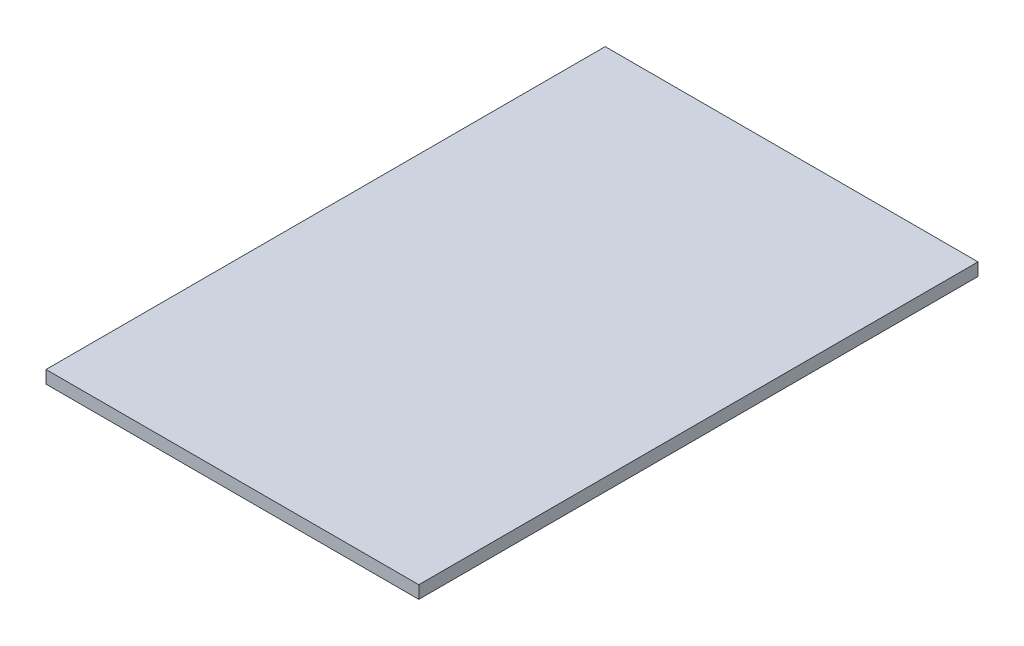
from build123d import *

# Parameters (mm, degrees)
SKETCH1_W           = 558.8
SKETCH1_H           = 838.2
BOSS_EXTRUDE1_DEPTH = 19.05


with BuildPart() as part:
    # Sketch1 → Boss-Extrude1 (new body)
    with BuildSketch(Plane(origin=(0, 0, 0), x_dir=(1, 0, 0), z_dir=(0, 1, 0))):
        with Locations((181.872119731, 340.598876734)):
            Rectangle(SKETCH1_W, SKETCH1_H)
    extrude(amount=BOSS_EXTRUDE1_DEPTH)


solid = part.part
